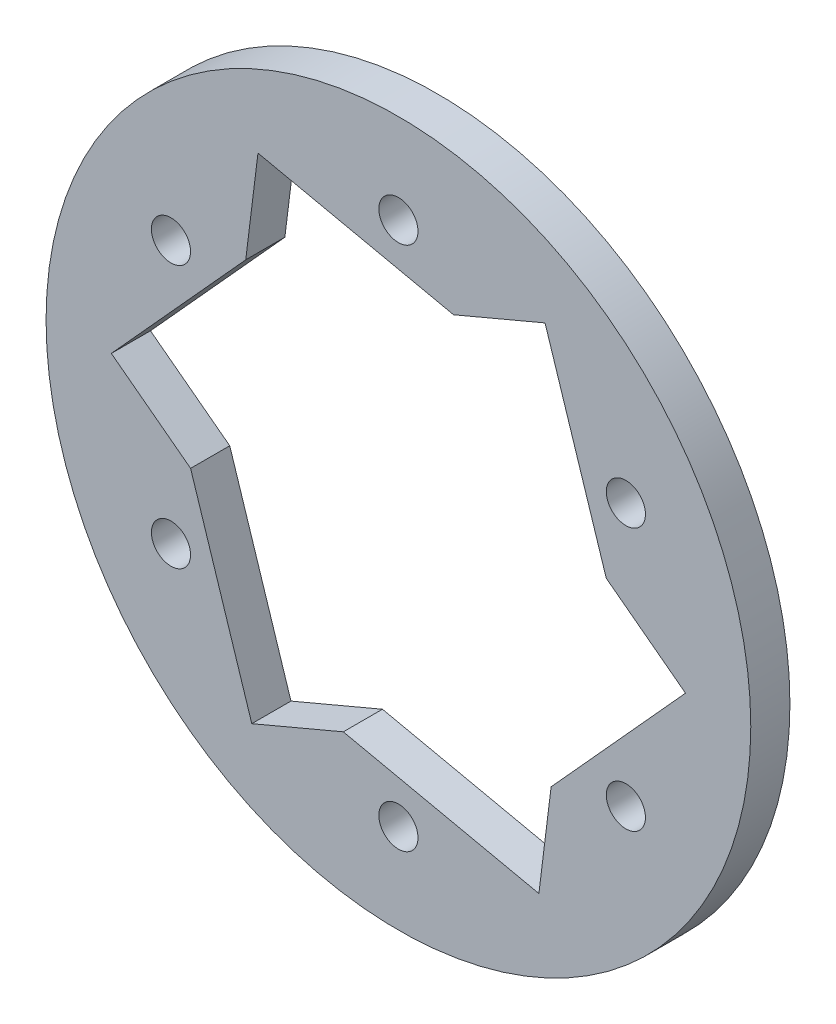
from build123d import *

# Parameters (mm, degrees)
MODEL_R                 = 27
MODEL_R_2               = 1.5
SALIENTE_EXTRUIR1_DEPTH = 3


with BuildPart() as part:
    # Model → Saliente-Extruir1 (new body)
    with BuildSketch(Plane.XY):
        with Locations((158.427277744, 241.952019993)):
            Circle(MODEL_R)
        with Locations((158.427277744, 262.076631791)):
            Circle(MODEL_R_2, mode=Mode.SUBTRACT)
        with Locations((140.998852686, 252.014325892)):
            Circle(MODEL_R_2, mode=Mode.SUBTRACT)
        with Locations((140.998852686, 231.889714094)):
            Circle(MODEL_R_2, mode=Mode.SUBTRACT)
        with Locations((158.427277744, 221.827408196)):
            Circle(MODEL_R_2, mode=Mode.SUBTRACT)
        with Locations((175.855702802, 231.889714094)):
            Circle(MODEL_R_2, mode=Mode.SUBTRACT)
        with Locations((175.855702802, 252.014325892)):
            Circle(MODEL_R_2, mode=Mode.SUBTRACT)
        Polygon((174.352685576, 246.268428845), (180.425586348, 241.679222344), (170.128101379, 230.318416671), (169.190182352, 222.764527077), (154.202693546, 226.002007819), (147.191873748, 223.037324726), (142.501869912, 237.635611142), (136.427281639, 242.226092863), (146.726454109, 253.585623316), (147.664373136, 261.139512909), (162.651861941, 257.902032168), (169.66268174, 260.86671526), align=None, mode=Mode.SUBTRACT)
    extrude(amount=SALIENTE_EXTRUIR1_DEPTH)


solid = part.part
